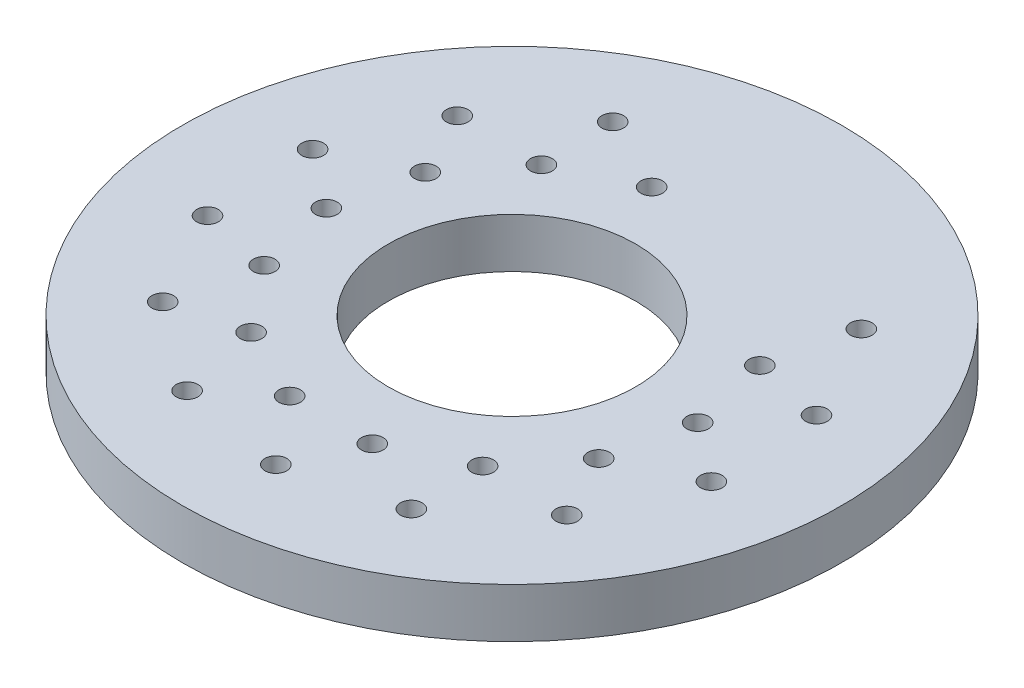
from build123d import *

# Parameters (mm, degrees)
SKETCH1_R           = 10.65
BOSS_EXTRUDE1_DEPTH = 1.6
SKETCH2_R           = 0.35
CUT_EXTRUDE1_DEPTH  = 44.909166683
SKETCH3_R           = 4
CUT_EXTRUDE2_DEPTH  = 44.909166683
SKETCH7_R           = 0.35
CUT_EXTRUDE6_DEPTH  = 10


with BuildPart() as part:
    # Sketch1 → Boss-Extrude1 (new body)
    with BuildSketch(Plane(origin=(0, 0, 0), x_dir=(1, 0, 0), z_dir=(0, 1, 0))):
        with Locations(Location((-21.736320014, 18.957113921, 0), (0, 0, 270))):
            Circle(SKETCH1_R)
    extrude(amount=BOSS_EXTRUDE1_DEPTH)

    # Sketch2 → Cut-Extrude1 (cut, through all)
    with BuildSketch(Plane(origin=(0, 1.6, 0), x_dir=(1, 0, 0), z_dir=(0, 1, 0))):
        with Locations(Location((-27.142133221, 21.560416356, 0), (0, 0, 270))):
            Circle(SKETCH2_R)
        with Locations(Location((-25.477258825, 23.648102816, 0), (0, 0, 270))):
            Circle(SKETCH2_R)
        with Locations(Location((-23.071445617, 24.806681394, 0), (0, 0, 270))):
            Circle(SKETCH2_R)
        with Locations(Location((-16.330506806, 21.560416356, 0), (0, 0, 270))):
            Circle(SKETCH2_R)
        with Locations(Location((-15.736320014, 18.957113921, 0), (0, 0, 270))):
            Circle(SKETCH2_R)
        with Locations(Location((-16.330506806, 16.353811486, 0), (0, 0, 270))):
            Circle(SKETCH2_R)
        with Locations(Location((-17.995381203, 14.266125026, 0), (0, 0, 270))):
            Circle(SKETCH2_R)
        with Locations(Location((-20.40119441, 13.107546448, 0), (0, 0, 270))):
            Circle(SKETCH2_R)
        with Locations(Location((-23.071445617, 13.107546448, 0), (0, 0, 270))):
            Circle(SKETCH2_R)
        with Locations(Location((-25.477258825, 14.266125026, 0), (0, 0, 270))):
            Circle(SKETCH2_R)
        with Locations(Location((-27.142133221, 16.353811486, 0), (0, 0, 270))):
            Circle(SKETCH2_R)
        with Locations(Location((-27.736320014, 18.957113921, 0), (0, 0, 270))):
            Circle(SKETCH2_R)
    extrude(amount=-CUT_EXTRUDE1_DEPTH, mode=Mode.SUBTRACT)

    # Sketch3 → Cut-Extrude2 (cut, through all)
    with BuildSketch(Plane(origin=(0, 1.6, 0), x_dir=(1, 0, 0), z_dir=(0, 1, 0))):
        with Locations(Location((-21.736320014, 18.957113921, 0), (0, 0, 270))):
            Circle(SKETCH3_R)
    extrude(amount=-CUT_EXTRUDE2_DEPTH, mode=Mode.SUBTRACT)

    # Sketch7 → Cut-Extrude6 (cut)
    with BuildSketch(Plane(origin=(0, 1.6, 0), x_dir=(1, 0, 0), z_dir=(0, 1, 0))):
        with Locations(Location((-27.760891742, 13.693604113, 0), (0, 0, 270))):
            Circle(SKETCH7_R)
        with Locations(Location((-29.448022899, 16.828819156, 0), (0, 0, 270))):
            Circle(SKETCH7_R)
        with Locations(Location((-29.607756722, 20.385569079, 0), (0, 0, 270))):
            Circle(SKETCH7_R)
        with Locations(Location((-28.208455969, 23.659395939, 0), (0, 0, 270))):
            Circle(SKETCH7_R)
        with Locations(Location((-25.527269313, 26.001878176, 0), (0, 0, 270))):
            Circle(SKETCH7_R)
        with Locations(Location((-15.711748286, 24.220623728, 0), (0, 0, 270))):
            Circle(SKETCH7_R)
        with Locations(Location((-14.024617128, 21.085408685, 0), (0, 0, 270))):
            Circle(SKETCH7_R)
        with Locations(Location((-24.880520267, 11.600891741, 0), (0, 0, 270))):
            Circle(SKETCH7_R)
        with Locations(Location((-13.864883305, 17.528658763, 0), (0, 0, 270))):
            Circle(SKETCH7_R)
        with Locations(Location((-15.264184059, 14.254831903, 0), (0, 0, 270))):
            Circle(SKETCH7_R)
        with Locations(Location((-17.945370714, 11.912349666, 0), (0, 0, 270))):
            Circle(SKETCH7_R)
        with Locations(Location((-21.377401371, 10.965169389, 0), (0, 0, 270))):
            Circle(SKETCH7_R)
    extrude(amount=-CUT_EXTRUDE6_DEPTH, mode=Mode.SUBTRACT)


solid = part.part
